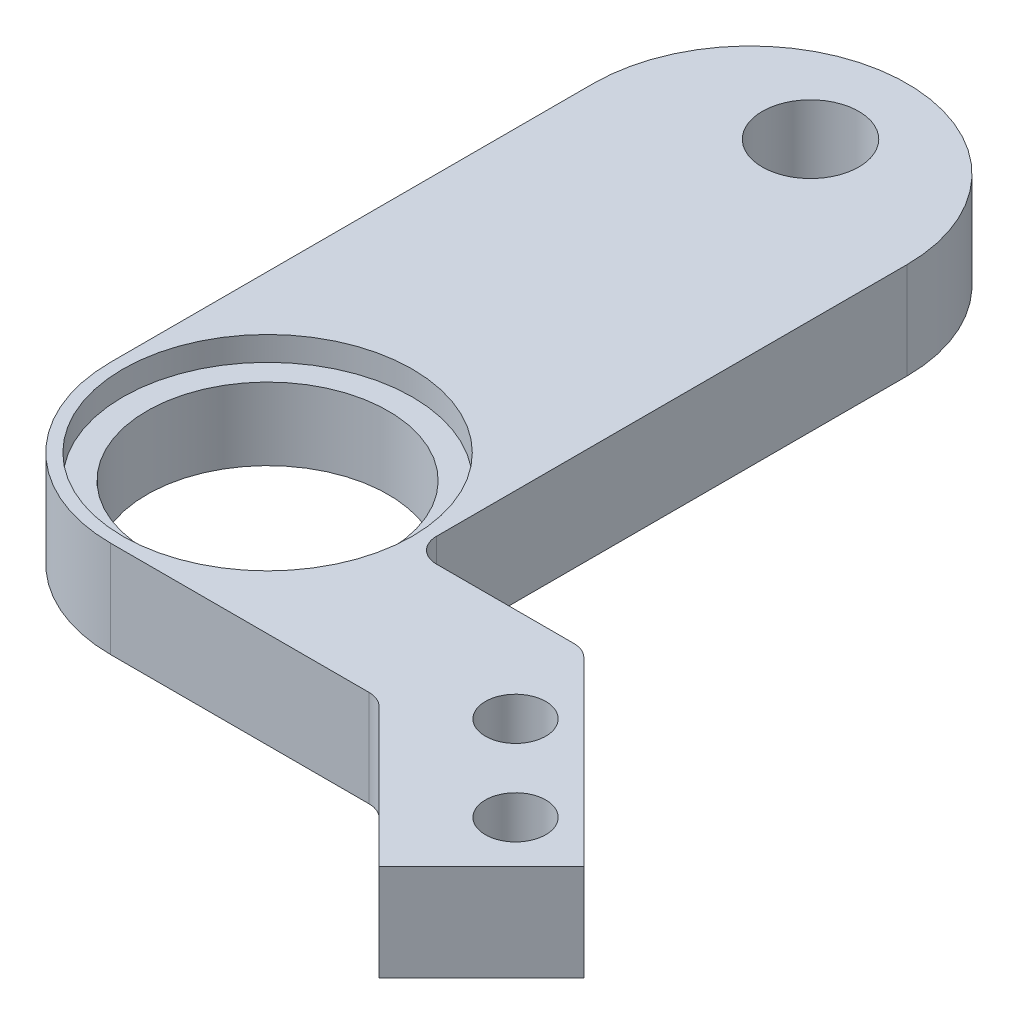
from build123d import *

# Parameters (mm, degrees)
BOSS_EXTRUDE1_DEPTH           = 4
DRAFT1_ANGLE                  = 45.000000004
DRAFT2_ANGLE                  = 45.000000005
F_4_0_4_DIAMETER_HOLE1_D      = 4
CSK_FOR_M3_SFHCS1_D           = 2.5
CSK_FOR_M3_SFHCS1_CSINK_D     = 4
CSK_FOR_M3_SFHCS1_CSINK_ANGLE = 90
FILLET1_R                     = 1
FILLET2_R                     = 6.5
HOLE2_D                       = 10
HOLE2_CBORE_D                 = 12
HOLE2_CBORE_DEPTH             = 1


with BuildPart() as part:
    # Sketch1 → Boss-Extrude1 (new body)
    with BuildSketch(Plane.XZ.offset(2)):
        with BuildLine():
            Line((11.12, 26.5), (-6.5, 26.5))
            Line((-6.5, 26.5), (-6.5, 0))
            ThreePointArc((-6.5, 0), (3e-09, -6.500000003), (6.500000005, 0))
            Line((6.500000005, 0), (6.500000005, 20.5))
            Line((6.500000005, 20.5), (13.605281374, 20.5))
            Line((13.605281374, 20.5), (13.605281374, 36.100603473))
            Line((13.605281374, 36.100603473), (11.12, 38.585884847))
            Line((11.12, 38.585884847), (11.12, 26.5))
        make_face()
    extrude(amount=-BOSS_EXTRUDE1_DEPTH)

    # Draft1
    draft1_faces = [part.faces().sort_by_distance(p)[0] for p in [
        (13.605281374, 0, 28.300301737),
    ]]
    draft(draft1_faces, Plane(origin=(6.500000005, 2, 20.5), x_dir=(-1, 0, 0), z_dir=(0, 0, -1)), DRAFT1_ANGLE)

    # Draft2
    draft2_faces = [part.faces().sort_by_distance(p)[0] for p in [
        (11.12, 0, 32.542942424),
    ]]
    draft(draft2_faces, Plane(origin=(11.12, 2, 26.5), x_dir=(1, 0, 0), z_dir=(0, 0, 1)), DRAFT2_ANGLE)

    # Ø4.0 (4) Diameter Hole1 (through all)
    with Locations(Plane(origin=(0, 2, 0), x_dir=(1, 0, 0), z_dir=(0, 1, 0))):
        with Locations((0, 2.5)):
            Hole(F_4_0_4_DIAMETER_HOLE1_D / 2)

    # CSK for M3 SFHCS1 (through all)
    with Locations(Plane(origin=(0, -2, 0), x_dir=(-1, 0, 0), z_dir=(0, -1, 0))):
        with Locations((-14.690228422, -24.413374173), (-18.225762328, -27.948908079)):
            CounterSinkHole(CSK_FOR_M3_SFHCS1_D / 2, CSK_FOR_M3_SFHCS1_CSINK_D / 2, counter_sink_angle=CSK_FOR_M3_SFHCS1_CSINK_ANGLE)

    # Fillet1
    fillet1_edges = [part.edges().sort_by_distance(p)[0] for p in [
        (13.605281374, 0, 20.5),
        (6.500000005, 0, 20.5),
        (11.12, 0, 26.5),
    ]]
    fillet(fillet1_edges, radius=FILLET1_R)

    # Fillet2
    fillet2_edges = [part.edges().sort_by_distance(p)[0] for p in [
        (-6.5, 0, 26.5),
    ]]
    fillet(fillet2_edges, radius=FILLET2_R)

    # Hole2 (through all)
    with Locations(Plane(origin=(0, 2, 20), x_dir=(0, 0, 1), z_dir=(0, 1, 0))):
        with Locations((0, 0)):
            CounterBoreHole(HOLE2_D / 2, HOLE2_CBORE_D / 2, HOLE2_CBORE_DEPTH)


solid = part.part
